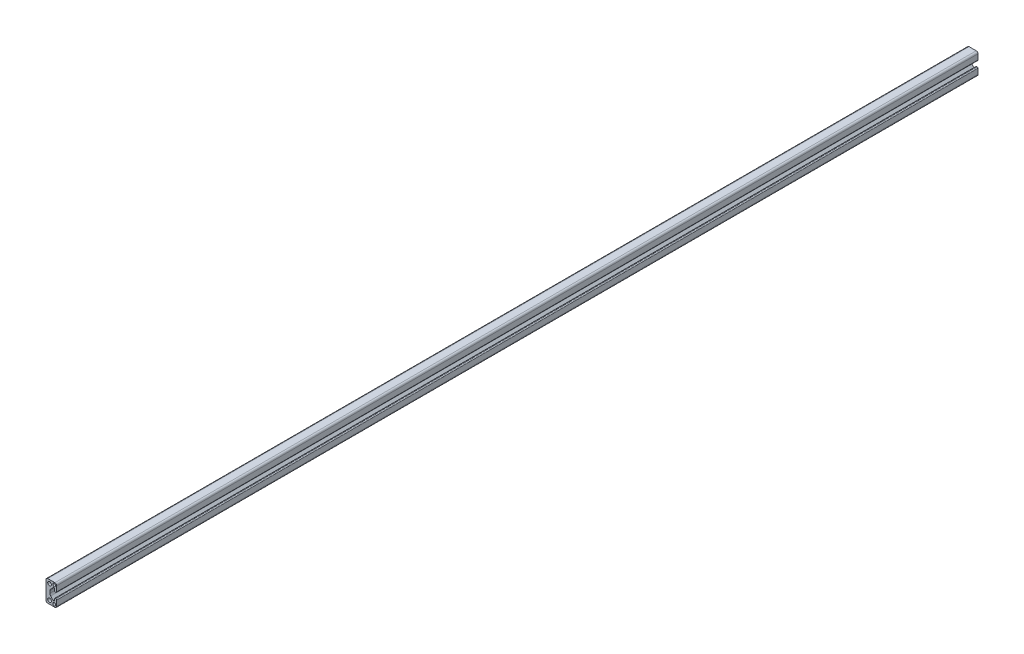
from build123d import *

# Parameters (mm, degrees)
SKETCH3_R           = 2.201333333
SKETCH3_R_2         = 1.693333333
BOSS_EXTRUDE1_DEPTH = 914.4
CUT_EXTRUDE1_DEPTH  = 733.425


with BuildPart() as part:
    # Sketch3 → Boss-Extrude1 (new, symmetric)
    with BuildSketch(Plane.XY):
        with BuildLine():
            Line((-1.778, 0), (-1.778, 1.27))
            ThreePointArc((-1.778, 1.27), (-1.536070654, 2.494011801), (-0.846666667, 3.533942971))
            Line((-0.846666667, 3.533942971), (2.413267273, 6.793876912))
            ThreePointArc((2.413267273, 6.793876912), (2.578074335, 6.903997469), (2.772477518, 6.942666667))
            Line((2.772477518, 6.942666667), (3.048, 6.942666667))
            ThreePointArc((3.048, 6.942666667), (3.467078619, 6.769078619), (3.640666667, 6.35))
            Line((3.640666667, 6.35), (3.640666667, 4.301066667))
            ThreePointArc((3.640666667, 4.301066667), (3.948165494, 3.558698827), (4.690533333, 3.2512))
            Line((4.690533333, 3.2512), (5.300133333, 3.2512))
            ThreePointArc((5.300133333, 3.2512), (6.042501173, 3.558698827), (6.35, 4.301066667))
            Line((6.35, 4.301066667), (6.35, 10.583333333))
            ThreePointArc((6.35, 10.583333333), (5.730042687, 12.080042687), (4.233333333, 12.7))
            Line((4.233333333, 12.7), (-4.233333333, 12.7))
            ThreePointArc((-4.233333333, 12.7), (-5.730042687, 12.080042687), (-6.35, 10.583333333))
            Line((-6.35, 10.583333333), (-6.35, 0))
            Line((-6.35, 0), (-1.778, 0))
        make_face()
        with Locations(Location((-2.116666667, 8.466666667, 0), (0, 0, 180))):
            Circle(SKETCH3_R, mode=Mode.SUBTRACT)
        with Locations(Location((3.429, 9.906, 0), (0, 0, 180))):
            Circle(SKETCH3_R_2, mode=Mode.SUBTRACT)
    extrude(amount=BOSS_EXTRUDE1_DEPTH, both=True)

    # Mirror1: part across plane


with BuildPart() as part_1:
    add(part.part)
    add(part.part.mirror(Plane.ZX))

    # Sketch4 → Cut-Extrude1 (cut)
    with BuildSketch(Plane.XY.offset(914.4)):
        with BuildLine():
            Line((-6.35, 10.583333333), (-6.35, -10.583333333))
            ThreePointArc((-6.35, -10.583333333), (-5.730042687, -12.080042687), (-4.233333333, -12.7))
            Line((-4.233333333, -12.7), (4.233333333, -12.7))
            ThreePointArc((4.233333333, -12.7), (5.730042687, -12.080042687), (6.35, -10.583333333))
            Line((6.35, -10.583333333), (6.35, -4.301066667))
            ThreePointArc((6.35, -4.301066667), (6.042501173, -3.558698827), (5.300133333, -3.2512))
            Line((5.300133333, -3.2512), (4.690533333, -3.2512))
            ThreePointArc((4.690533333, -3.2512), (3.948165494, -3.558698827), (3.640666667, -4.301066667))
            Line((3.640666667, -4.301066667), (3.640666667, -6.35))
            ThreePointArc((3.640666667, -6.35), (3.467078619, -6.769078619), (3.048, -6.942666667))
            Line((3.048, -6.942666667), (2.772477518, -6.942666667))
            ThreePointArc((2.772477518, -6.942666667), (2.578074335, -6.903997469), (2.413267273, -6.793876912))
            Line((2.413267273, -6.793876912), (-0.846666667, -3.533942971))
            ThreePointArc((-0.846666667, -3.533942971), (-1.536070654, -2.494011801), (-1.778, -1.27))
            Line((-1.778, -1.27), (-1.778, 1.27))
            ThreePointArc((-1.778, 1.27), (-1.536070654, 2.494011801), (-0.846666667, 3.533942971))
            Line((-0.846666667, 3.533942971), (2.413267273, 6.793876912))
            ThreePointArc((2.413267273, 6.793876912), (2.578074335, 6.903997469), (2.772477518, 6.942666667))
            Line((2.772477518, 6.942666667), (3.048, 6.942666667))
            ThreePointArc((3.048, 6.942666667), (3.467078619, 6.769078619), (3.640666667, 6.35))
            Line((3.640666667, 6.35), (3.640666667, 4.301066667))
            ThreePointArc((3.640666667, 4.301066667), (3.948165494, 3.558698827), (4.690533333, 3.2512))
            Line((4.690533333, 3.2512), (5.300133333, 3.2512))
            ThreePointArc((5.300133333, 3.2512), (6.042501173, 3.558698827), (6.35, 4.301066667))
            Line((6.35, 4.301066667), (6.35, 10.583333333))
            ThreePointArc((6.35, 10.583333333), (5.730042687, 12.080042687), (4.233333333, 12.7))
            Line((4.233333333, 12.7), (-4.233333333, 12.7))
            ThreePointArc((-4.233333333, 12.7), (-5.730042687, 12.080042687), (-6.35, 10.583333333))
        make_face()
    extrude(amount=-CUT_EXTRUDE1_DEPTH, mode=Mode.SUBTRACT)


solid = part_1.part
